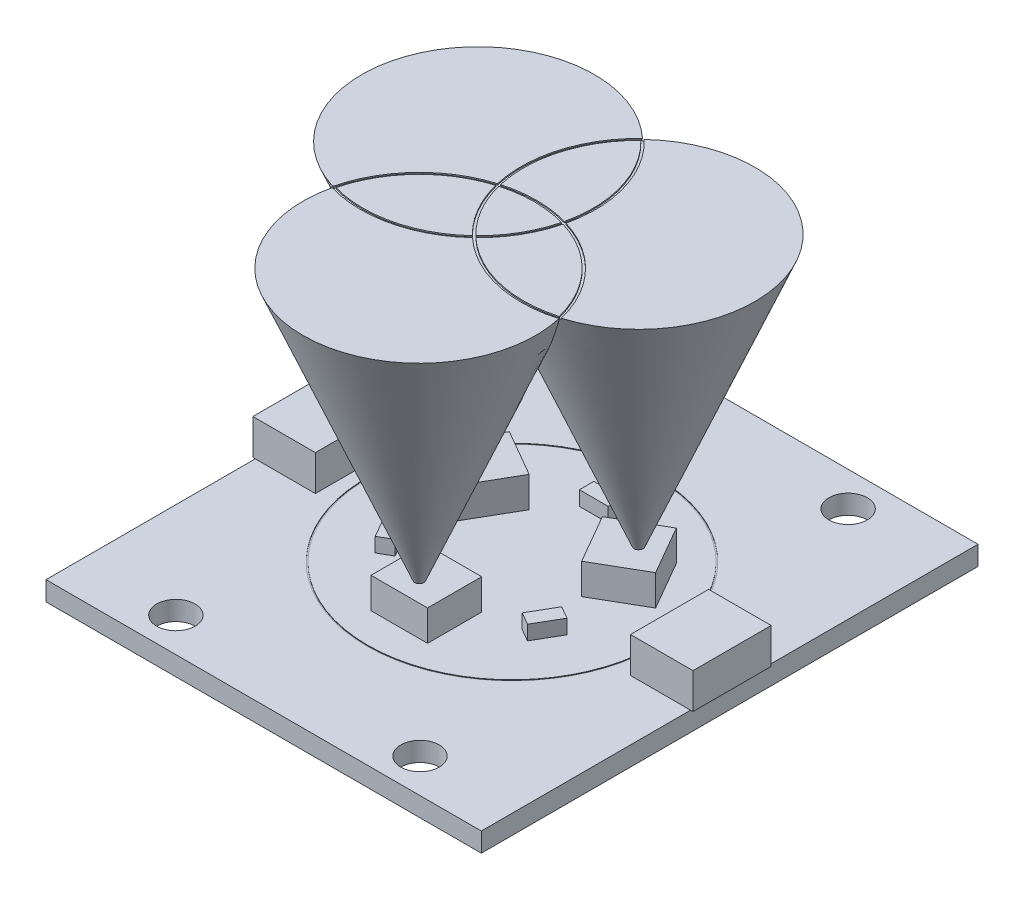
from build123d import *

# Parameters (mm, degrees)
SKETCH1_W           = 36.2
SKETCH1_H           = 41.3
SKETCH1_R           = 1.6
BOSS_EXTRUDE1_DEPTH = 1.6
SKETCH2_W           = 5.2
SKETCH2_H           = 6.5
BOSS_EXTRUDE2_DEPTH = 2.95
SKETCH3_W           = 4.7
SKETCH3_H           = 4.5
BOSS_EXTRUDE3_DEPTH = 2.55
SKETCH4_W           = 2.4
SKETCH4_H           = 1.2
BOSS_EXTRUDE4_DEPTH = 1.2
SKETCH5_R           = 12.1
SKETCH5_R_2         = 12
CUT_EXTRUDE1_DEPTH  = 0.05
SKETCH6_R           = 0.375
CUT_EXTRUDE2_DEPTH  = 28.825752461
CIRPATTERN2_COUNT   = 3
CUT_EXTRUDE3_DEPTH  = 0.1


with BuildPart() as part:
    # Sketch1 → Boss-Extrude1 (new body)
    with BuildSketch(Plane(origin=(0, 0, 0), x_dir=(1, 0, 0), z_dir=(0, 1, 0))):
        Rectangle(SKETCH1_W, SKETCH1_H)
        with Locations(Location((-10.15, 17.8, 0), (0, 0, 270))):
            Circle(SKETCH1_R, mode=Mode.SUBTRACT)
        with Locations(Location((10.15, 17.8, 0), (0, 0, 270))):
            Circle(SKETCH1_R, mode=Mode.SUBTRACT)
        with Locations(Location((-10.15, -17.8, 0), (0, 0, 270))):
            Circle(SKETCH1_R, mode=Mode.SUBTRACT)
        with Locations(Location((10.15, -17.8, 0), (0, 0, 270))):
            Circle(SKETCH1_R, mode=Mode.SUBTRACT)
    extrude(amount=BOSS_EXTRUDE1_DEPTH)

    # Sketch2 → Boss-Extrude2 (add)
    with BuildSketch(Plane(origin=(0, 1.6, 0), x_dir=(1, 0, 0), z_dir=(0, 1, 0))):
        with Locations((-15.7, 0)):
            Rectangle(SKETCH2_W, SKETCH2_H)
        with Locations((15.7, 0)):
            Rectangle(SKETCH2_W, SKETCH2_H)
    extrude(amount=BOSS_EXTRUDE2_DEPTH)

    # Sketch3 → Boss-Extrude3 (add)
    with BuildSketch(Plane(origin=(0, 1.6, 0), x_dir=(1, 0, 0), z_dir=(0, 1, 0))):
        Polygon((-6.941670728, 6.721321728), (-3.04455641, 4.471321728), (-5.39455641, 0.401002331), (-9.291670728, 2.651002331), align=None)
        Polygon((3.04455641, 4.471321728), (6.941670728, 6.721321728), (9.291670728, 2.651002331), (5.39455641, 0.401002331), align=None)
        with Locations((0, -7.122324059)):
            Rectangle(SKETCH3_W, SKETCH3_H)
    extrude(amount=BOSS_EXTRUDE3_DEPTH)

    # Sketch4 → Boss-Extrude4 (add)
    with BuildSketch(Plane(origin=(0, 1.6, 0), x_dir=(1, 0, 0), z_dir=(0, 1, 0))):
        with Locations((0, 7.403377608)):
            Rectangle(SKETCH4_W, SKETCH4_H)
        Polygon((6.49189784, -2.362458319), (5.29189784, -4.440919288), (6.331128324, -5.040919288), (7.531128324, -2.962458319), align=None)
        Polygon((-6.49189784, -2.362458319), (-5.29189784, -4.440919288), (-6.331128324, -5.040919288), (-7.531128324, -2.962458319), align=None)
    extrude(amount=BOSS_EXTRUDE4_DEPTH)

    # Sketch5 → Cut-Extrude1 (cut)
    with BuildSketch(Plane(origin=(0, 1.6, 0), x_dir=(1, 0, 0), z_dir=(0, 1, 0))):
        with Locations(Location((0, 0, 0), (0, 0, 270))):
            Circle(SKETCH5_R)
        with Locations(Location((0, 0, 0), (0, 0, 270))):
            Circle(SKETCH5_R_2, mode=Mode.SUBTRACT)
    extrude(amount=-CUT_EXTRUDE1_DEPTH, mode=Mode.SUBTRACT)

    # Sketch6 → Cut-Extrude2 (cut, through all)
    with BuildSketch(Plane(origin=(0, 3.6, 0), x_dir=(1, 0, 0), z_dir=(0, 1, 0))):
        with Locations(Location((-6.674097159, 3.853291792, 0), (0, 0, 270))):
            Circle(SKETCH6_R)
        with Locations(Location((6.674097159, 3.853291792, 0), (0, 0, 270))):
            Circle(SKETCH6_R)
        with Locations(Location((0, -7.706583583, 0), (0, 0, 270))):
            Circle(SKETCH6_R)
    extrude(amount=CUT_EXTRUDE2_DEPTH, mode=Mode.SUBTRACT)

    # Sketch7 → Revolve3 (revolve)
    with BuildSketch(Plane(origin=(0, 0, 0), x_dir=(0, 0, -1), z_dir=(1, 0, 0)), mode=Mode.PRIVATE) as revolve3_sk:
        Polygon((1.967510892, 26.6), (-7.706583583, 26.6), (-7.706583583, 3.6), (-7.331583583, 3.6), (-7.331583583, 4.15), align=None)
    revolve3 = revolve(revolve3_sk.sketch.rotate(Axis((0, 26.6, 7.706583583), (0, -1, 0)), 180), axis=Axis((0, 26.6, 7.706583583), (0, -1, 0)))

    # CirPattern2: Revolve3 ×3 about axis
    cirpattern2_axis = Axis((0, 0, 0), (0, 1, 0))
    for i in range(1, CIRPATTERN2_COUNT):
        add(revolve3.rotate(cirpattern2_axis, i * 360 / CIRPATTERN2_COUNT))

    # Sketch8 → Cut-Extrude3 (cut)
    with BuildSketch(Plane(origin=(0, 26.6, 0), x_dir=(1, 0, 0), z_dir=(0, 1, 0))):
        with BuildLine():
            Line((-9.49791005, -5.399501553), (-9.425060538, -5.52568061))
            ThreePointArc((-9.425060538, -5.52568061), (-4.415728318, -5.656318768), (0, -3.287390943))
            ThreePointArc((0, -3.287390943), (4.415728318, -5.656318768), (9.425060538, -5.52568061))
            Line((9.425060538, -5.52568061), (9.49791005, -5.399501553))
            ThreePointArc((9.49791005, -5.399501553), (7.106379904, -0.995973516), (2.846964069, 1.643695472))
            ThreePointArc((2.846964069, 1.643695472), (2.690651586, 6.652292283), (0.072849512, 10.925182163))
            Line((0.072849512, 10.925182163), (-0.072849512, 10.925182163))
            ThreePointArc((-0.072849512, 10.925182163), (-2.690651586, 6.652292283), (-2.846964069, 1.643695472))
            ThreePointArc((-2.846964069, 1.643695472), (-7.106379904, -0.995973516), (-9.49791005, -5.399501553))
        make_face()
        with BuildLine():
            ThreePointArc((0, -3.011088161), (1.617311874, -0.933755446), (2.60767884, 1.50554408))
            ThreePointArc((2.60767884, 1.50554408), (0, 1.867510892), (-2.60767884, 1.50554408))
            ThreePointArc((-2.60767884, 1.50554408), (-1.617311874, -0.933755446), (0, -3.011088161))
        make_face(mode=Mode.SUBTRACT)
        with BuildLine():
            ThreePointArc((0, 10.717671744), (-2.510270593, 6.557117602), (-2.654727509, 1.700081323))
            ThreePointArc((-2.654727509, 1.700081323), (0, 2.067510892), (2.654727509, 1.700081323))
            ThreePointArc((2.654727509, 1.700081323), (2.510270593, 6.557117602), (0, 10.717671744))
        make_face(mode=Mode.SUBTRACT)
        with BuildLine():
            ThreePointArc((-9.281776, -5.358835872), (-4.423495123, -5.452516905), (-0.14494986, -3.149102125))
            ThreePointArc((-0.14494986, -3.149102125), (-1.790516955, -1.033755446), (-2.799677369, 1.449020802))
            ThreePointArc((-2.799677369, 1.449020802), (-6.933765715, -1.104600697), (-9.281776, -5.358835872))
        make_face(mode=Mode.SUBTRACT)
        with BuildLine():
            ThreePointArc((9.281776, -5.358835872), (6.933765715, -1.104600697), (2.799677369, 1.449020802))
            ThreePointArc((2.799677369, 1.449020802), (1.790516955, -1.033755446), (0.14494986, -3.149102125))
            ThreePointArc((0.14494986, -3.149102125), (4.423495123, -5.452516905), (9.281776, -5.358835872))
        make_face(mode=Mode.SUBTRACT)
    extrude(amount=-CUT_EXTRUDE3_DEPTH, mode=Mode.SUBTRACT)


solid = part.part
